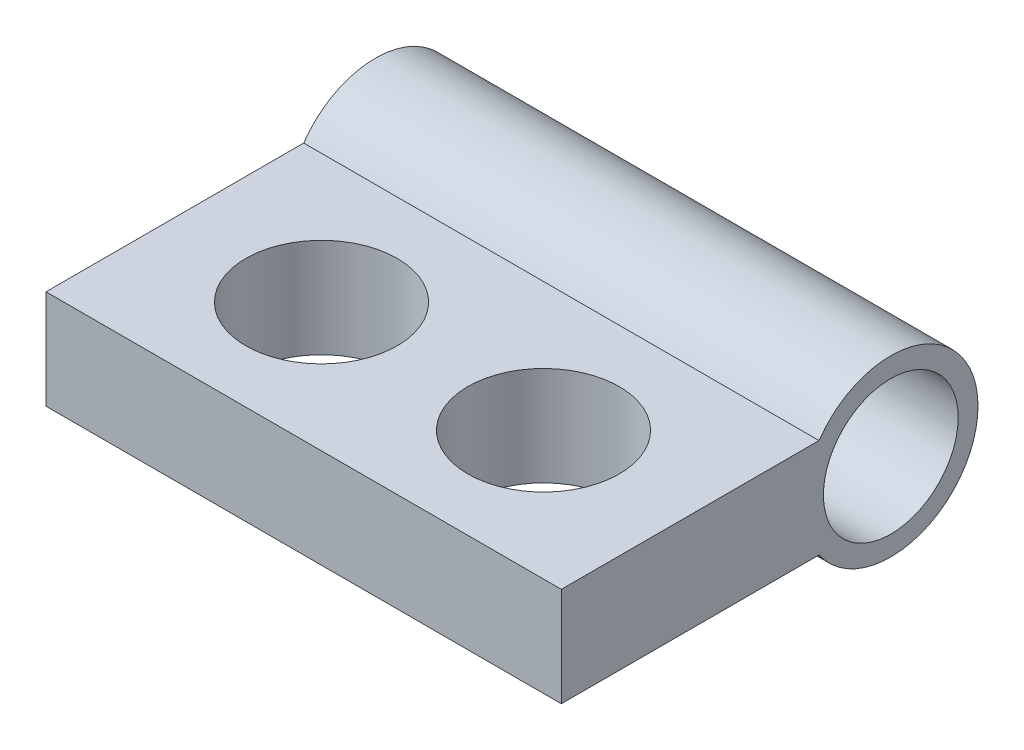
from build123d import *

# Parameters (mm, degrees)
SKETCH1_W           = 82.55
SKETCH1_H           = 41.275
SKETCH1_R           = 12.1285
BOSS_EXTRUDE1_DEPTH = 15.875
SKETCH2_R           = 13.97
SKETCH2_R_2         = 10.795
BOSS_EXTRUDE2_DEPTH = 82.55


with BuildPart() as part:
    # Sketch1 → Boss-Extrude1 (new body)
    with BuildSketch(Plane(origin=(0, 0, 0), x_dir=(1, 0, 0), z_dir=(0, 1, 0))):
        Rectangle(SKETCH1_W, SKETCH1_H)
        with Locations(Location((17.78, 0, 0), (0, 0, 270))):
            Circle(SKETCH1_R, mode=Mode.SUBTRACT)
        with Locations(Location((-17.78, 0, 0), (0, 0, 90))):
            Circle(SKETCH1_R, mode=Mode.SUBTRACT)
    extrude(amount=BOSS_EXTRUDE1_DEPTH)

    # Sketch2 → Boss-Extrude2 (add)
    with BuildSketch(Plane(origin=(41.275, 0, 0), x_dir=(0, 0, -1), z_dir=(1, 0, 0))):
        with Locations((32.133455539, 7.9375)):
            Circle(SKETCH2_R)
        with Locations((32.133455539, 7.9375)):
            Circle(SKETCH2_R_2, mode=Mode.SUBTRACT)
    extrude(amount=-BOSS_EXTRUDE2_DEPTH)


solid = part.part
